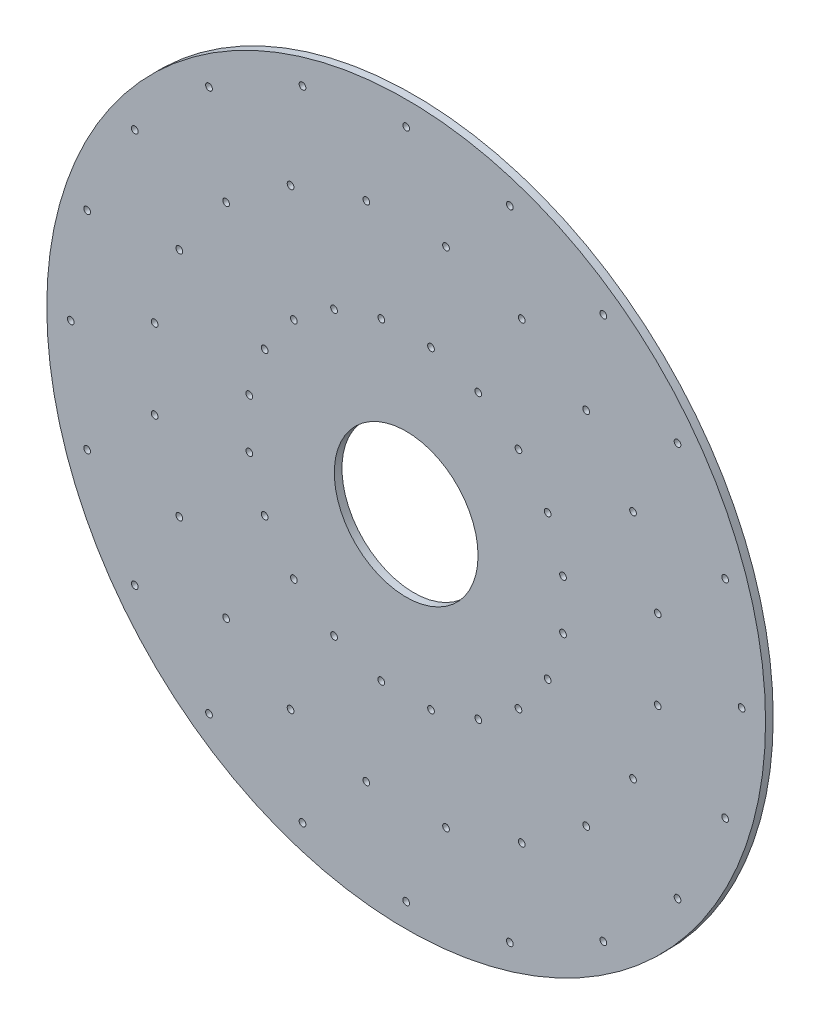
from build123d import *

# Parameters (mm, degrees)
SKETCH1_R           = 187.5
BOSS_EXTRUDE1_DEPTH = 4
SKETCH2_R           = 37.5
CUT_EXTRUDE1_DEPTH  = 266.195211118
SKETCH3_R           = 1.755
CUT_EXTRUDE2_DEPTH  = 266.195211118
CIRPATTERN1_COUNT   = 20
SKETCH4_R           = 1.755
CUT_EXTRUDE3_DEPTH  = 266.195211118
CIRPATTERN2_COUNT   = 20


with BuildPart() as part:
    # Sketch1 → Boss-Extrude1 (new body)
    with BuildSketch(Plane.XY):
        Circle(SKETCH1_R)
    extrude(amount=BOSS_EXTRUDE1_DEPTH)

    # Sketch2 → Cut-Extrude1 (cut, through all)
    with BuildSketch(Plane.XY.offset(4)):
        Circle(SKETCH2_R)
    extrude(amount=-CUT_EXTRUDE1_DEPTH, mode=Mode.SUBTRACT)

    # Sketch3 → Cut-Extrude2 (cut, through all)
    with BuildSketch(Plane.XY.offset(4)):
        with Locations((0, 175)):
            Circle(SKETCH3_R)
    cut_extrude2 = extrude(amount=-CUT_EXTRUDE2_DEPTH, mode=Mode.SUBTRACT)

    # CirPattern1: Cut-Extrude2 ×20 about axis
    cirpattern1_axis = Axis((0, 0, -0.2), (0, 0, 1))
    for i in range(1, CIRPATTERN1_COUNT):
        add(cut_extrude2.rotate(cirpattern1_axis, i * 360 / CIRPATTERN1_COUNT), mode=Mode.SUBTRACT)

    # Sketch4 → Cut-Extrude3 (cut, through all)
    with BuildSketch(Plane.XY.offset(4)):
        with Locations((73.815845007, 37.611051607)):
            Circle(SKETCH4_R)
        with Locations((118.366171216, 60.310576594)):
            Circle(SKETCH4_R)
    cut_extrude3 = extrude(amount=-CUT_EXTRUDE3_DEPTH, mode=Mode.SUBTRACT)

    # CirPattern2: Cut-Extrude3 ×20 about axis
    cirpattern2_axis = Axis((0, 0, -0.2), (0, 0, 1))
    for i in range(1, CIRPATTERN2_COUNT):
        add(cut_extrude3.rotate(cirpattern2_axis, i * 360 / CIRPATTERN2_COUNT), mode=Mode.SUBTRACT)


solid = part.part
